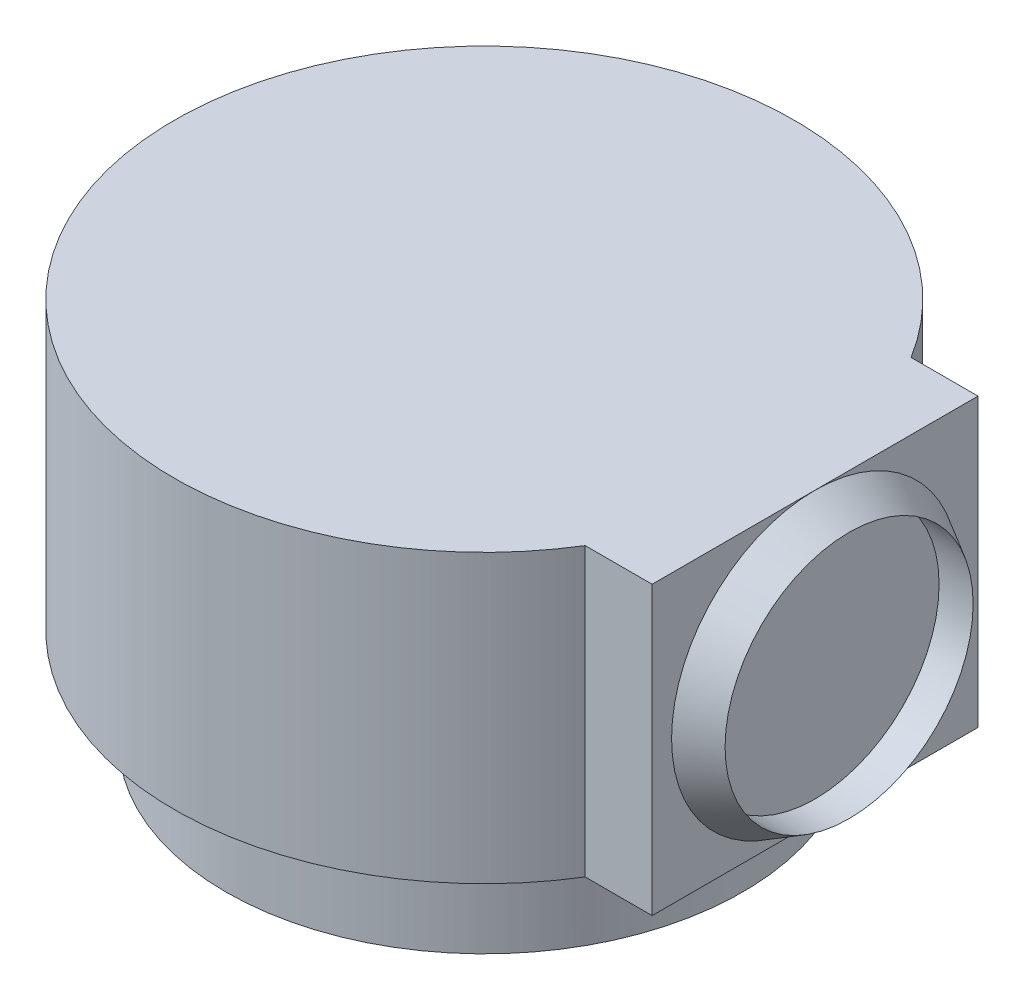
from build123d import *

# Parameters (mm, degrees)
SKETCH1_R           = 159.375
BOSS_EXTRUDE1_DEPTH = 147.5
SKETCH2_W           = 167.5
SKETCH2_H           = 147.5
BOSS_EXTRUDE2_DEPTH = 170
SKETCH5_R           = 132.8125
BOSS_EXTRUDE3_DEPTH = 50


with BuildPart() as part:
    # Sketch1 → Boss-Extrude1 (new body)
    with BuildSketch(Plane(origin=(0, 0, 0), x_dir=(1, 0, 0), z_dir=(0, 1, 0))):
        with Locations(Location((0, 0, 0), (0, 0, 270))):
            Circle(SKETCH1_R)
    extrude(amount=BOSS_EXTRUDE1_DEPTH)

    # Sketch2 → Boss-Extrude2 (add)
    with BuildSketch(Plane(origin=(0, 0, 0), x_dir=(0, 0, -1), z_dir=(1, 0, 0))):
        with Locations((0, 73.75)):
            Rectangle(SKETCH2_W, SKETCH2_H)
    extrude(amount=BOSS_EXTRUDE2_DEPTH)

    # Sketch4 → Revolve1 (revolve)
    with BuildSketch(Plane.XY, mode=Mode.PRIVATE) as revolve1_sk:
        Polygon((170, 0), (170, 10), (187.5, 10), align=None)
    revolve(revolve1_sk.sketch.rotate(Axis((170, 73.75, 0), (1, 0, 0)), 270), axis=Axis((170, 73.75, 0), (1, 0, 0)))

    # Sketch5 → Boss-Extrude3 (add)
    with BuildSketch(Plane(origin=(0, 0, 0), x_dir=(-1, 0, 0), z_dir=(0, -1, 0))):
        with Locations(Location((0, 0, 0), (0, 0, 270))):
            Circle(SKETCH5_R)
    extrude(amount=BOSS_EXTRUDE3_DEPTH)


solid = part.part
